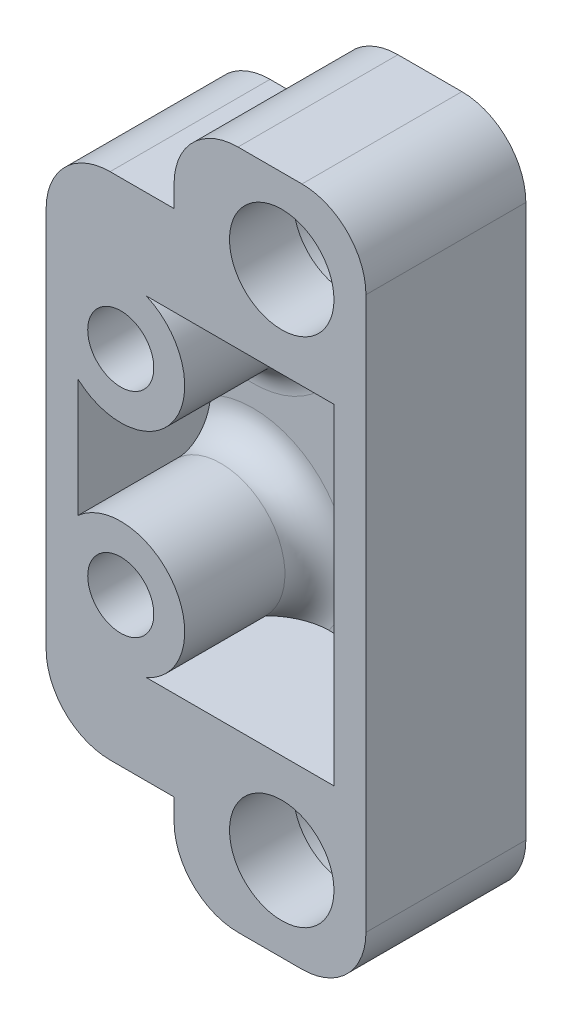
from build123d import *

# Parameters (mm, degrees)
SKETCH1_W                       = 20.480821918
SKETCH1_H                       = 31.9
SKETCH1_R                       = 2.45
BOSS_EXTRUDE1_DEPTH             = 7.5
SKETCH2_W                       = 18.980821918
SKETCH2_H                       = 9.35
CUT_EXTRUDE1_DEPTH              = 6.2
CUT_EXTRUDE2_REACH              = 22.384
SKETCH5_W                       = 5.480821918
SKETCH5_H                       = 31.9
SKETCH3_R                       = 3
SKETCH3_R_2                     = 1.55
BOSS_EXTRUDE4_DEPTH             = 6.2
SKETCH6_W                       = 1.5
SKETCH6_H                       = 15.5
CUT_EXTRUDE3_DEPTH              = 6.2
SKETCH7_W                       = 1.5
SKETCH7_H                       = 18.7
BOSS_EXTRUDE5_DEPTH             = 6.2
FILLET1_R                       = 3
SKETCH8_W                       = 6
SKETCH8_H                       = 4
CUT_EXTRUDE4_DEPTH              = 7.5
FILLET2_R                       = 3
BOSS_EXTRUDE6_REACH             = 21.943
BOSS_EXTRUDE6_DIRECTION_2_REACH = 21.943
SKETCH10_R                      = 3.25
CUT_EXTRUDE6_DEPTH              = 4.5
FILLET3_R                       = 1.5
SKETCH12_W                      = 1.5
SKETCH12_H                      = 15.5
BOSS_EXTRUDE7_DEPTH             = 6.2


with BuildPart() as part:
    # Sketch1 → Boss-Extrude1 (new body)
    with BuildSketch(Plane.XY):
        Rectangle(SKETCH1_W, SKETCH1_H)
        with Locations((6.290410959, 12)):
            Circle(SKETCH1_R, mode=Mode.SUBTRACT)
        with Locations((6.290410959, -12)):
            Circle(SKETCH1_R, mode=Mode.SUBTRACT)
    extrude(amount=BOSS_EXTRUDE1_DEPTH)

    # Sketch2 → Cut-Extrude1 (cut)
    with BuildSketch(Plane.XY.offset(7.5)):
        with Locations((-0.75, 4.675)):
            Rectangle(SKETCH2_W, SKETCH2_H)
        with Locations((-0.75, -4.675)):
            Rectangle(SKETCH2_W, SKETCH2_H)
    extrude(amount=-CUT_EXTRUDE1_DEPTH, mode=Mode.SUBTRACT)

    # Cut-Extrude2: up to this face of the body (flat: up to its plane)
    cut_extrude2_end = Plane(part.part.faces().sort_by_distance((-0.385368256, 0, 0))[0])
    # Sketch5 → Cut-Extrude2 (cut, up to the picked face)
    with BuildSketch(Plane.XY.offset(7.5), mode=Mode.PRIVATE) as cut_extrude2_sk1:
        with Locations((-7.5, 0)):
            Rectangle(SKETCH5_W, SKETCH5_H)
    cut_extrude2_tool1 = split(extrude(cut_extrude2_sk1.sketch, amount=-CUT_EXTRUDE2_REACH, mode=Mode.PRIVATE), bisect_by=cut_extrude2_end, keep=Keep.BOTH, mode=Mode.PRIVATE)
    add(cut_extrude2_tool1.solids().sort_by(Axis((-7.5, 0, 7.5), (0, 0, -1)))[0], mode=Mode.SUBTRACT)

    # Sketch3 → Boss-Extrude4 (add)
    # profile 1 of 2: a face of its own
    with BuildSketch(Plane.XY.offset(1.3)):
        with Locations(Location((-1.259589041, 5, 0), (0, 0, 180))):
            Circle(SKETCH3_R)
        with Locations(Location((-1.259589041, 5, 0), (0, 0, 180))):
            Circle(SKETCH3_R_2, mode=Mode.SUBTRACT)
    # profile 2 of 2: a face of its own
    with BuildSketch(Plane.XY.offset(1.3)):
        with Locations(Location((-1.259589041, -5, 0), (0, 0, 180))):
            Circle(SKETCH3_R)
        with Locations(Location((-1.259589041, -5, 0), (0, 0, 180))):
            Circle(SKETCH3_R_2, mode=Mode.SUBTRACT)
    extrude(amount=BOSS_EXTRUDE4_DEPTH)

    # Sketch6 → Cut-Extrude3 (cut)
    with BuildSketch(Plane.XY.offset(7.5)):
        with Locations((9.490410959, 0)):
            Rectangle(SKETCH6_W, SKETCH6_H)
    extrude(amount=-CUT_EXTRUDE3_DEPTH, mode=Mode.SUBTRACT)

    # Sketch7 → Boss-Extrude5 (add)
    with BuildSketch(Plane.XY.offset(1.3)):
        with Locations((-4.009589041, 0)):
            Rectangle(SKETCH7_W, SKETCH7_H)
    extrude(amount=BOSS_EXTRUDE5_DEPTH)

    # Fillet1
    fillet1_edges = [part.edges().sort_by_distance(p)[0] for p in [
        (10.240410959, 15.95, 3.75),
        (10.240410959, -15.95, 3.75),
    ]]
    fillet(fillet1_edges, radius=FILLET1_R)

    # Sketch8 → Cut-Extrude4 (cut)
    with BuildSketch(Plane.XY.offset(7.5)):
        with Locations((-1.759589041, 13.95)):
            Rectangle(SKETCH8_W, SKETCH8_H)
        with Locations((-1.759589041, -13.95)):
            Rectangle(SKETCH8_W, SKETCH8_H)
    extrude(amount=-CUT_EXTRUDE4_DEPTH, mode=Mode.SUBTRACT)

    # Fillet2
    fillet2_edges = [part.edges().sort_by_distance(p)[0] for p in [
        (1.240410959, 15.95, 3.75),
        (-4.759589041, 11.95, 3.75),
        (1.240410959, -15.95, 3.75),
        (-4.759589041, -11.95, 3.75),
    ]]
    fillet(fillet2_edges, radius=FILLET2_R)

    # Boss-Extrude6: up to this face of the body (flat: up to its plane)
    boss_extrude6_end = Plane(part.part.faces().sort_by_distance((5.740410959, -15.597493262, 7.5))[0])
    # Sketch11 → Boss-Extrude6 (add, up to the picked face)
    with BuildSketch(Plane.XY.offset(1.3), mode=Mode.PRIVATE) as boss_extrude6_sk1:
        with BuildLine():
            Line((-3.259589041, 9.35), (-3.259589041, 7.236067977))
            ThreePointArc((-3.259589041, 7.236067977), (-1.735455251, 7.962018121), (-0.06063116, 7.75))
            Line((-0.06063116, 7.75), (8.740410959, 7.75))
            Line((8.740410959, 7.75), (8.740410959, 9.35))
            Line((8.740410959, 9.35), (-3.259589041, 9.35))
        make_face()
    boss_extrude6_tool1 = split(extrude(boss_extrude6_sk1.sketch, amount=BOSS_EXTRUDE6_REACH, mode=Mode.PRIVATE), bisect_by=boss_extrude6_end, keep=Keep.BOTH, mode=Mode.PRIVATE)
    # Sketch11 → Boss-Extrude6 (add, up to the picked face)
    with BuildSketch(Plane.XY.offset(1.3), mode=Mode.PRIVATE) as boss_extrude6_sk2:
        with BuildLine():
            Line((-3.259589041, -7.236067977), (-3.259589041, -9.35))
            Line((-3.259589041, -9.35), (8.740410959, -9.35))
            Line((8.740410959, -9.35), (8.740410959, -7.75))
            Line((8.740410959, -7.75), (-0.06063116, -7.75))
            ThreePointArc((-0.06063116, -7.75), (-1.735455251, -7.962018121), (-3.259589041, -7.236067977))
        make_face()
    boss_extrude6_tool2 = split(extrude(boss_extrude6_sk2.sketch, amount=BOSS_EXTRUDE6_REACH, mode=Mode.PRIVATE), bisect_by=boss_extrude6_end, keep=Keep.BOTH, mode=Mode.PRIVATE)
    add(boss_extrude6_tool1.solids().sort_by(Axis((2.770321, 8.555653, 1.3), (0, 0, 1)))[0])
    add(boss_extrude6_tool2.solids().sort_by(Axis((2.770321, -8.555653, 1.3), (0, 0, 1)))[0])

    # Boss-Extrude6 direction 2: up to this face of the body (flat: up to its plane)
    boss_extrude6_direction_2_end = Plane(part.part.faces().sort_by_distance((2.964227546, 0, 0))[0])
    # Sketch11 → Boss-Extrude6 direction 2 (add, up to the picked face)
    with BuildSketch(Plane.XY.offset(1.3), mode=Mode.PRIVATE) as boss_extrude6_direction_2_sk1:
        with BuildLine():
            Line((-3.259589041, 9.35), (-3.259589041, 7.236067977))
            ThreePointArc((-3.259589041, 7.236067977), (-1.735455251, 7.962018121), (-0.06063116, 7.75))
            Line((-0.06063116, 7.75), (8.740410959, 7.75))
            Line((8.740410959, 7.75), (8.740410959, 9.35))
            Line((8.740410959, 9.35), (-3.259589041, 9.35))
        make_face()
    boss_extrude6_direction_2_tool1 = split(extrude(boss_extrude6_direction_2_sk1.sketch, amount=-BOSS_EXTRUDE6_DIRECTION_2_REACH, mode=Mode.PRIVATE), bisect_by=boss_extrude6_direction_2_end, keep=Keep.BOTH, mode=Mode.PRIVATE)
    # Sketch11 → Boss-Extrude6 direction 2 (add, up to the picked face)
    with BuildSketch(Plane.XY.offset(1.3), mode=Mode.PRIVATE) as boss_extrude6_direction_2_sk2:
        with BuildLine():
            Line((-3.259589041, -7.236067977), (-3.259589041, -9.35))
            Line((-3.259589041, -9.35), (8.740410959, -9.35))
            Line((8.740410959, -9.35), (8.740410959, -7.75))
            Line((8.740410959, -7.75), (-0.06063116, -7.75))
            ThreePointArc((-0.06063116, -7.75), (-1.735455251, -7.962018121), (-3.259589041, -7.236067977))
        make_face()
    boss_extrude6_direction_2_tool2 = split(extrude(boss_extrude6_direction_2_sk2.sketch, amount=-BOSS_EXTRUDE6_DIRECTION_2_REACH, mode=Mode.PRIVATE), bisect_by=boss_extrude6_direction_2_end, keep=Keep.BOTH, mode=Mode.PRIVATE)
    add(boss_extrude6_direction_2_tool1.solids().sort_by(Axis((2.770321, 8.555653, 1.3), (0, 0, -1)))[0])
    add(boss_extrude6_direction_2_tool2.solids().sort_by(Axis((2.770321, -8.555653, 1.3), (0, 0, -1)))[0])

    # Sketch10 → Cut-Extrude6 (cut)
    with BuildSketch(Plane(origin=(0, 0, 0), x_dir=(-1, 0, 0), z_dir=(0, 0, -1))):
        with Locations((-6.290410959, 12)):
            Circle(SKETCH10_R)
        with Locations((-6.290410959, -12)):
            Circle(SKETCH10_R)
    extrude(amount=-CUT_EXTRUDE6_DEPTH, mode=Mode.SUBTRACT)

    # Fillet3
    fillet3_edges = [part.edges().sort_by_distance(p)[0] for p in [
        (1.265413056, 3.380010984, 1.3),
        (1.265413056, -3.380010984, 1.3),
    ]]
    fillet(fillet3_edges, radius=FILLET3_R)

    # Sketch12 → Boss-Extrude7 (add)
    with BuildSketch(Plane.XY.offset(1.3)):
        with Locations((9.490410959, 0)):
            Rectangle(SKETCH12_W, SKETCH12_H)
    extrude(amount=BOSS_EXTRUDE7_DEPTH)


solid = part.part
